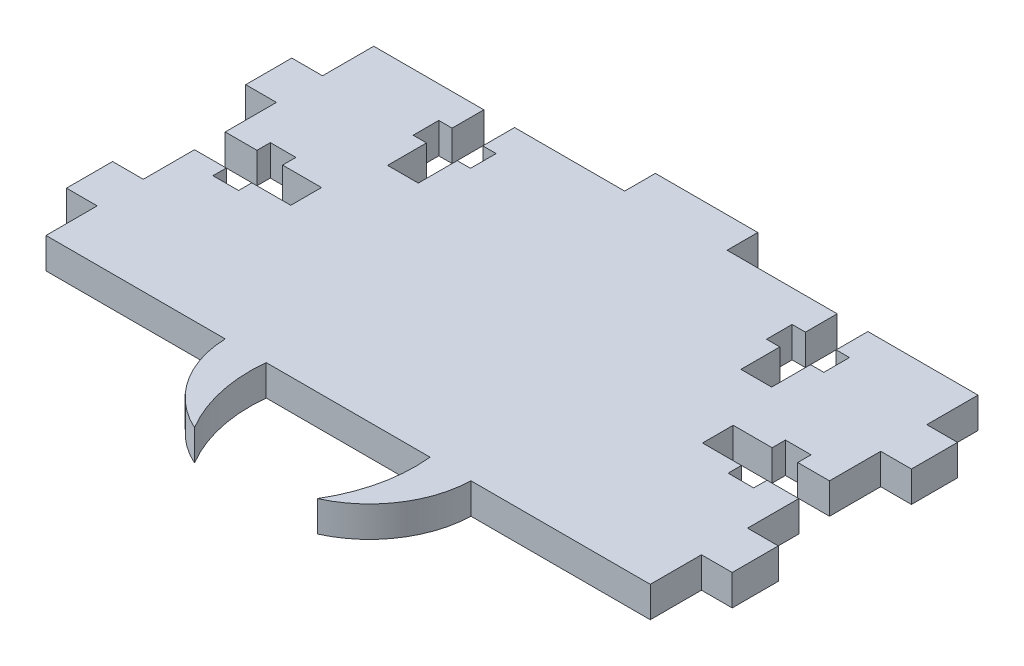
from build123d import *

# Parameters (mm, degrees)
BOSS_EXTRUDE1_DEPTH = 3


with BuildPart() as part:
    # Sketch1 → Boss-Extrude1 (new body)
    with BuildSketch(Plane(origin=(0, 0, 0), x_dir=(1, 0, 0), z_dir=(0, 1, 0))):
        with BuildLine():
            Line((0, 27), (3, 27))
            Line((3, 27), (3, 22.5))
            Line((3, 22.5), (0, 22.5))
            Line((0, 22.5), (0, 17.5))
            Line((0, 17.5), (-3.1, 17.5))
            Line((-3.1, 17.5), (-3.1, 18.8))
            Line((-3.1, 18.8), (-5.6, 18.8))
            Line((-5.6, 18.8), (-5.6, 17.5))
            Line((-5.6, 17.5), (-9.4, 17.5))
            Line((-9.4, 17.5), (-9.4, 14.5))
            Line((-9.4, 14.5), (-5.6, 14.5))
            Line((-5.6, 14.5), (-5.6, 13.2))
            Line((-5.6, 13.2), (-3.1, 13.2))
            Line((-3.1, 13.2), (-3.1, 14.5))
            Line((-3.1, 14.5), (0, 14.5))
            Line((0, 14.5), (0, 9.5))
            Line((0, 9.5), (3, 9.5))
            Line((3, 9.5), (3, 5))
            Line((3, 5), (0, 5))
            Line((0, 5), (0, 0))
            Line((0, 0), (-17.5, 0))
            ThreePointArc((-17.5, 0), (-19.217483451, -5.355011032), (-23.5, -9))
            ThreePointArc((-23.5, -9), (-21.768352481, -4.662588338), (-21.5, 0))
            Line((-21.5, 0), (-37.5, 0))
            ThreePointArc((-37.5, 0), (-37.231647519, -4.662588338), (-35.5, -9))
            ThreePointArc((-35.5, -9), (-39.782516549, -5.355011032), (-41.5, 0))
            Line((-41.5, 0), (-59, 0))
            Line((-59, 0), (-59, 5))
            Line((-59, 5), (-62, 5))
            Line((-62, 5), (-62, 9.5))
            Line((-62, 9.5), (-59, 9.5))
            Line((-59, 9.5), (-59, 14.5))
            Line((-59, 14.5), (-55.9, 14.5))
            Line((-55.9, 14.5), (-55.9, 13.2))
            Line((-55.9, 13.2), (-53.4, 13.2))
            Line((-53.4, 13.2), (-53.4, 14.5))
            Line((-53.4, 14.5), (-49.6, 14.5))
            Line((-49.6, 14.5), (-49.6, 17.5))
            Line((-49.6, 17.5), (-53.4, 17.5))
            Line((-53.4, 17.5), (-53.4, 18.8))
            Line((-53.4, 18.8), (-55.9, 18.8))
            Line((-55.9, 18.8), (-55.9, 17.5))
            Line((-55.9, 17.5), (-59, 17.5))
            Line((-59, 17.5), (-59, 22.5))
            Line((-59, 22.5), (-62, 22.5))
            Line((-62, 22.5), (-62, 27))
            Line((-62, 27), (-59, 27))
            Line((-59, 27), (-59, 32))
            Line((-59, 32), (-48.25, 32))
            Line((-48.25, 32), (-48.25, 28.9))
            Line((-48.25, 28.9), (-49.55, 28.9))
            Line((-49.55, 28.9), (-49.55, 26.4))
            Line((-49.55, 26.4), (-48.25, 26.4))
            Line((-48.25, 26.4), (-48.25, 22.6))
            Line((-48.25, 22.6), (-45.25, 22.6))
            Line((-45.25, 22.6), (-45.25, 26.4))
            Line((-45.25, 26.4), (-43.95, 26.4))
            Line((-43.95, 26.4), (-43.95, 28.9))
            Line((-43.95, 28.9), (-45.25, 28.9))
            Line((-45.25, 28.9), (-45.25, 32))
            Line((-45.25, 32), (-34.5, 32))
            Line((-34.5, 32), (-34.5, 35))
            Line((-34.5, 35), (-24.5, 35))
            Line((-24.5, 35), (-24.5, 32))
            Line((-24.5, 32), (-13.75, 32))
            Line((-13.75, 32), (-13.75, 28.9))
            Line((-13.75, 28.9), (-15.05, 28.9))
            Line((-15.05, 28.9), (-15.05, 26.4))
            Line((-15.05, 26.4), (-13.75, 26.4))
            Line((-13.75, 26.4), (-13.75, 22.6))
            Line((-13.75, 22.6), (-10.75, 22.6))
            Line((-10.75, 22.6), (-10.75, 26.4))
            Line((-10.75, 26.4), (-9.45, 26.4))
            Line((-9.45, 26.4), (-9.45, 28.9))
            Line((-9.45, 28.9), (-10.75, 28.9))
            Line((-10.75, 28.9), (-10.75, 32))
            Line((-10.75, 32), (0, 32))
            Line((0, 32), (0, 27))
        make_face()
    extrude(amount=BOSS_EXTRUDE1_DEPTH)


solid = part.part
